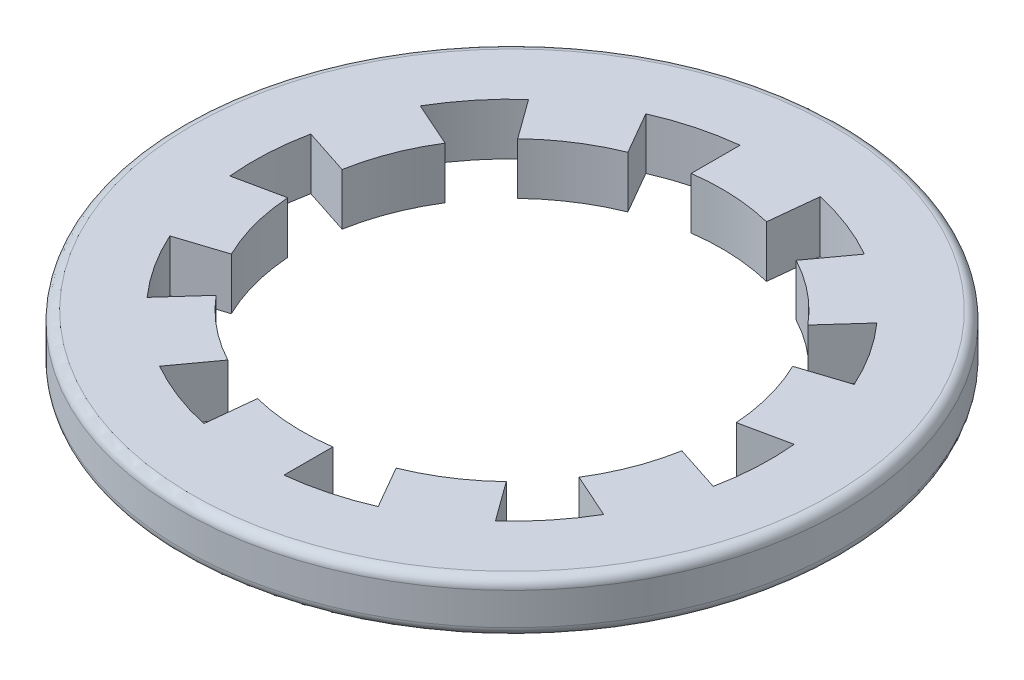
from build123d import *

# Parameters (mm, degrees)
SKETCH_1_W          = 5.1
SKETCH_1_H          = 0.8
CUT_EXTRUDE_1_DEPTH = 8.256721023
FILLET_1_R          = 0.15


with BuildPart() as part:
    # 草图1 → 旋转1 (revolve)
    with BuildSketch(Plane.XY):
        with Locations((2.55, 68.708527966)):
            Rectangle(SKETCH_1_W, SKETCH_1_H)
    revolve(axis=Axis((0, 69.108527966, 0), (0, -1, 0)))

    # 草图2 → 切除-拉伸1 (cut, through all)
    with BuildSketch(Plane(origin=(0, 69.108527966, 0), x_dir=(-1, 0, 0), z_dir=(0, 1, 0))):
        with BuildLine():
            Line((-3.199553455, 0.570374573), (-3.918273635, 0.804424081))
            ThreePointArc((-3.918273635, 0.804424081), (-3.994373733, 0.21199127), (-3.981407211, -0.385168448))
            Line((-3.981407211, -0.385168448), (-3.241952523, -0.228501177))
            ThreePointArc((-3.241952523, -0.228501177), (-3.139811906, -0.839077143), (-2.923750279, -1.419209101))
            Line((-2.923750279, -1.419209101), (-3.642772796, -1.65232263))
            ThreePointArc((-3.642772796, -1.65232263), (-3.356118206, -2.176334942), (-2.994630559, -2.651820418))
            Line((-2.994630559, -2.651820418), (-2.488484708, -2.090434413))
            ThreePointArc((-2.488484708, -2.090434413), (-2.046963571, -2.524364167), (-1.531172889, -2.866703062))
            Line((-1.531172889, -2.866703062), (-1.975859509, -3.477924527))
            ThreePointArc((-1.975859509, -3.477924527), (-1.435936071, -3.733365668), (-0.863994936, -3.905559842))
            Line((-0.863994936, -3.905559842), (-0.784496864, -3.153893672))
            ThreePointArc((-0.784496864, -3.153893672), (-0.172242423, -3.245430066), (0.446261515, -3.219213824))
            Line((0.446261515, -3.219213824), (0.445759758, -3.975082601))
            ThreePointArc((0.445759758, -3.975082601), (1.032712913, -3.864387477), (1.596638706, -3.667524283))
            Line((1.596638706, -3.667524283), (1.219138949, -3.012671786))
            ThreePointArc((1.219138949, -3.012671786), (1.768268328, -2.726851874), (2.253240152, -2.342094254))
            Line((2.253240152, -2.342094254), (2.697131397, -2.953893593))
            ThreePointArc((2.697131397, -2.953893593), (3.106915443, -2.519331172), (3.447420884, -2.028593455))
            Line((3.447420884, -2.028593455), (2.75711029, -1.720709844))
            ThreePointArc((2.75711029, -1.720709844), (3.033363561, -1.166707614), (3.199558641, -0.570374203))
            Line((3.199558641, -0.570374203), (3.918278822, -0.80442371))
            ThreePointArc((3.918278822, -0.80442371), (3.994378087, -0.211986219), (3.981409517, 0.385177991))
            Line((3.981409517, 0.385177991), (3.241957709, 0.228501547))
            ThreePointArc((3.241957709, 0.228501547), (3.139817092, 0.83907751), (2.923755466, 1.419209465))
            Line((2.923755466, 1.419209465), (3.642783633, 1.65231108))
            ThreePointArc((3.642783633, 1.65231108), (3.356126982, 2.176329766), (2.994635746, 2.651820782))
            Line((2.994635746, 2.651820782), (2.488489895, 2.090434778))
            ThreePointArc((2.488489895, 2.090434778), (2.046968759, 2.524364531), (1.531178079, 2.866703425))
            Line((1.531178079, 2.866703425), (1.975864699, 3.477924889))
            ThreePointArc((1.975864699, 3.477924889), (1.435941262, 3.733366031), (0.864000127, 3.905560207))
            Line((0.864000127, 3.905560207), (0.784502055, 3.153894037))
            ThreePointArc((0.784502055, 3.153894037), (0.172247613, 3.245430432), (-0.446256324, 3.21921419))
            Line((-0.446256324, 3.21921419), (-0.445754567, 3.975082967))
            ThreePointArc((-0.445754567, 3.975082967), (-1.032707749, 3.864387836), (-1.596633567, 3.667524629))
            Line((-1.596633567, 3.667524629), (-1.219133759, 3.012672153))
            ThreePointArc((-1.219133759, 3.012672153), (-1.768263138, 2.726852242), (-2.253234963, 2.342094623))
            Line((-2.253234963, 2.342094623), (-2.697126207, 2.953893962))
            ThreePointArc((-2.697126207, 2.953893962), (-3.106910254, 2.519331541), (-3.447415696, 2.028593825))
            Line((-3.447415696, 2.028593825), (-2.757105101, 1.720710213))
            ThreePointArc((-2.757105101, 1.720710213), (-3.033358374, 1.166707983), (-3.199553455, 0.570374573))
        make_face()
    extrude(amount=-CUT_EXTRUDE_1_DEPTH, mode=Mode.SUBTRACT)

    # 圆角1
    fillet_1_edges = [part.edges().sort_by_distance(p)[0] for p in [
        (-5.1, 68.308527966, 0),
        (-5.1, 69.108527966, 0),
    ]]
    fillet(fillet_1_edges, radius=FILLET_1_R)


solid = part.part
